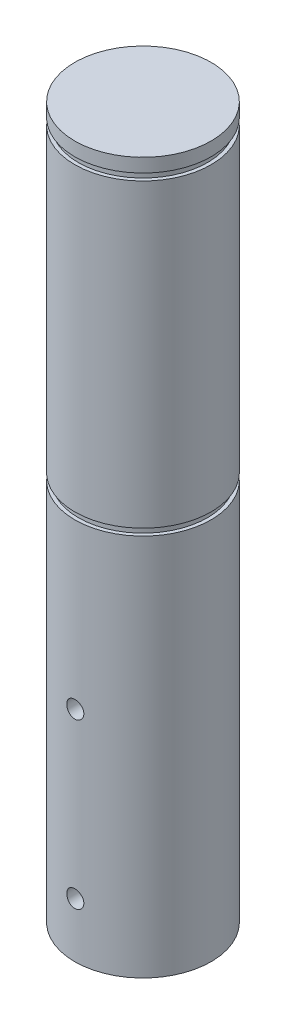
from build123d import *

# Parameters (mm, degrees)
SKETCH_1_R        = 9.975
EXTRUDE_1_DEPTH   = 40
SKETCH_5_R        = 9.975
F_16MM_DEPTH      = 16
SKETCH_6_R        = 9.45
EXTRUDE_1_2_DEPTH = 1
SKETCH_7_R        = 9.975
EXTRUDE_4_DEPTH   = 44
SKETCH_8_R        = 9.45
EXTRUDE_2_DEPTH   = 1
SKETCH_9_R        = 9.975
EXTRUDE_6_DEPTH   = 2


with BuildPart() as part:
    # 草图1 → Extrude 1 (new body)
    with BuildSketch(Plane(origin=(0, 0, 0), x_dir=(1, 0, 0), z_dir=(0, 1, 0))):
        with Locations(Location((5.9, 0, 0), (0, 0, 270))):
            Circle(SKETCH_1_R)
    extrude(amount=EXTRUDE_1_DEPTH)

    # 草图5 → 16mm 铰链间距 (add)
    with BuildSketch(Plane(origin=(0, 40, 0), x_dir=(1, 0, 0), z_dir=(0, 1, 0))):
        with Locations(Location((5.9, 0, 0), (0, 0, 270))):
            Circle(SKETCH_5_R)
    extrude(amount=F_16MM_DEPTH)

    # 草图6 → Extrude 1 2 (add)
    with BuildSketch(Plane(origin=(0, 56, 0), x_dir=(1, 0, 0), z_dir=(0, 1, 0))):
        with Locations(Location((5.9, 0, 0), (0, 0, 270))):
            Circle(SKETCH_6_R)
    extrude(amount=EXTRUDE_1_2_DEPTH)

    # 草图7 → 凸台-拉伸4 (add)
    with BuildSketch(Plane(origin=(0, 57, 0), x_dir=(1, 0, 0), z_dir=(0, 1, 0))):
        with Locations(Location((5.9, 0, 0), (0, 0, 270))):
            Circle(SKETCH_7_R)
    extrude(amount=EXTRUDE_4_DEPTH)

    # 草图8 → 卡簧2 (add)
    with BuildSketch(Plane(origin=(0, 101, 0), x_dir=(1, 0, 0), z_dir=(0, 1, 0))):
        with Locations(Location((5.9, 0, 0), (0, 0, 270))):
            Circle(SKETCH_8_R)
    extrude(amount=EXTRUDE_2_DEPTH)

    # 草图9 → 凸台-拉伸6 (add)
    with BuildSketch(Plane(origin=(0, 102, 0), x_dir=(1, 0, 0), z_dir=(0, 1, 0))):
        with Locations(Location((5.9, 0, 0), (0, 0, 270))):
            Circle(SKETCH_9_R)
    extrude(amount=EXTRUDE_6_DEPTH)

    # 草图22 → M3 螺纹孔7 (revolve, cut)
    with BuildSketch(Plane(origin=(5.9, 8, 9.975), x_dir=(0, -1, 0), z_dir=(1, 0, 0))):
        Polygon((0, 0), (0, 8.251075774), (1.25, 7.5), (1.25, 0), align=None)
    hole_wizard_m3_7 = revolve(axis=Axis((5.9, 8, 16.325), (0, 0, -1)), mode=Mode.SUBTRACT)

    # 镜向1: M3 螺纹孔7 across plane
    add(hole_wizard_m3_7.mirror(Plane(origin=(0, 20, 0), x_dir=(0, 0, 1), z_dir=(0, -1, 0))), mode=Mode.SUBTRACT)


solid = part.part
